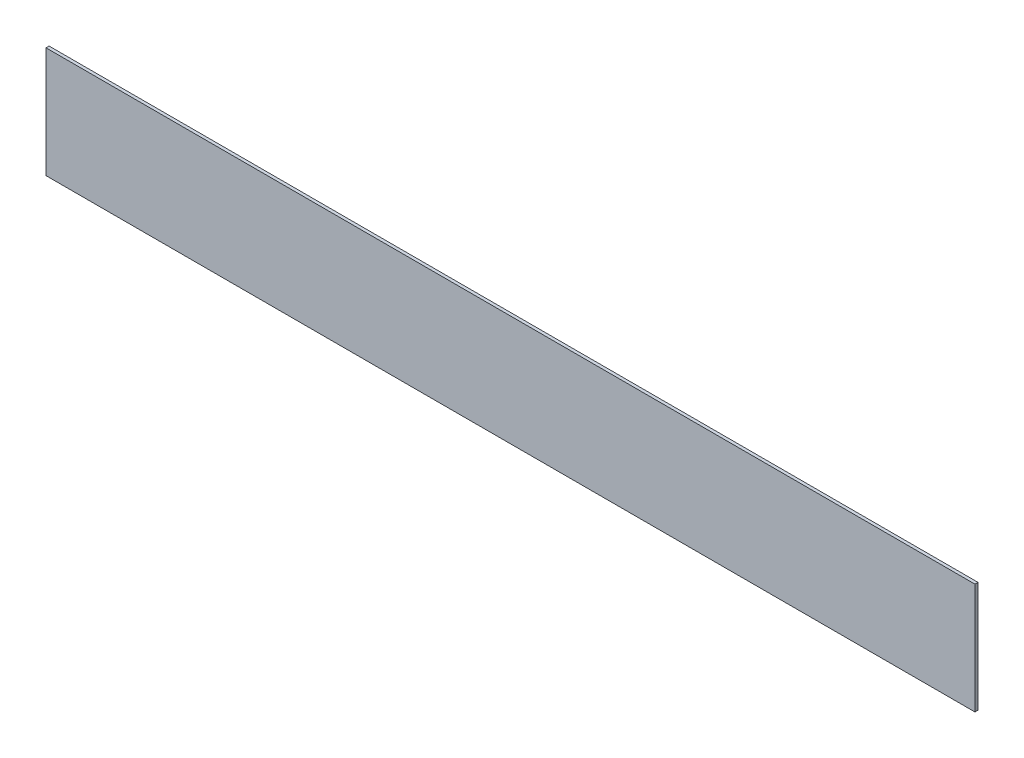
from build123d import *

# Parameters (mm, degrees)
CEK_TAZE_KULP_CUKURU_1_0_1_START = 26
SKETCH1_W                        = 302
SKETCH1_H                        = 36
CEK_TAZE_KULP_CUKURU_1_0_1_DEPTH = 1


with BuildPart() as part:
    # Sketch1 → CEK_taze_kulp_cukuru_1.0_1 (new body)
    with BuildSketch(Plane.XY.offset(CEK_TAZE_KULP_CUKURU_1_0_1_START)):
        with Locations((309, 50)):
            Rectangle(SKETCH1_W, SKETCH1_H)
    extrude(amount=CEK_TAZE_KULP_CUKURU_1_0_1_DEPTH)


solid = part.part
